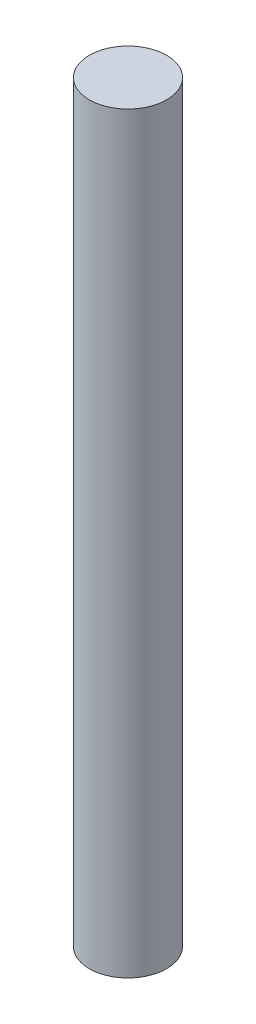
from build123d import *

# Parameters (mm, degrees)
SKETCH1_R           = 2.5
BOSS_EXTRUDE1_DEPTH = 48.699999882


with BuildPart() as part:
    # Sketch1 → Boss-Extrude1 (new body)
    with BuildSketch(Plane(origin=(0, 0, 0), x_dir=(1, 0, 0), z_dir=(0, 1, 0))):
        with Locations(Location((0, 0, 0), (0, 0, 270))):
            Circle(SKETCH1_R)
    extrude(amount=BOSS_EXTRUDE1_DEPTH)


solid = part.part
